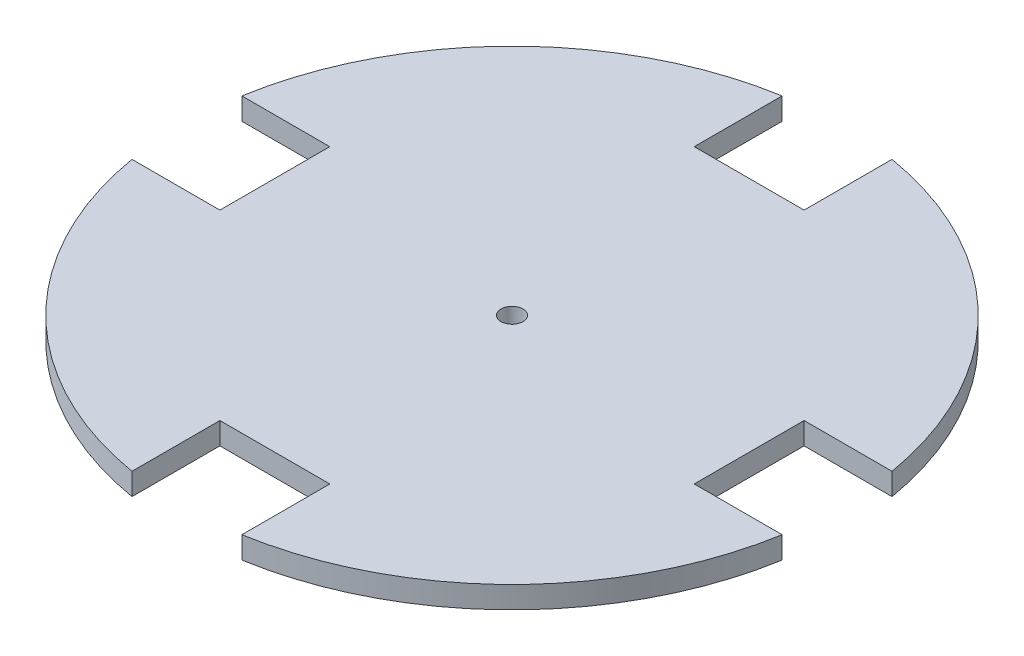
from build123d import *

# Parameters (mm, degrees)
SKETCH2_R           = 5
BOSS_EXTRUDE1_DEPTH = 5


with BuildPart() as part:
    # Sketch2 → Boss-Extrude1 (new, symmetric)
    with BuildSketch(Plane(origin=(0, 0, 0), x_dir=(1, 0, 0), z_dir=(0, 1, 0))):
        with BuildLine():
            Line((107.901994577, 25), (147.901994577, 25))
            ThreePointArc((147.901994577, 25), (106.066017178, 106.066017178), (25, 147.901994577))
            Line((25, 147.901994577), (25, 107.901994577))
            Line((25, 107.901994577), (-25, 107.901994577))
            Line((-25, 107.901994577), (-25, 147.901994577))
            ThreePointArc((-25, 147.901994577), (-106.066017178, 106.066017178), (-147.901994577, 25))
            Line((-147.901994577, 25), (-107.901994577, 25))
            Line((-107.901994577, 25), (-107.901994577, -25))
            Line((-107.901994577, -25), (-147.901994577, -25))
            ThreePointArc((-147.901994577, -25), (-106.066017178, -106.066017178), (-25, -147.901994577))
            Line((-25, -147.901994577), (-25, -107.901994577))
            Line((-25, -107.901994577), (25, -107.901994577))
            Line((25, -107.901994577), (25, -147.901994577))
            ThreePointArc((25, -147.901994577), (106.066017178, -106.066017178), (147.901994577, -25))
            Line((147.901994577, -25), (107.901994577, -25))
            Line((107.901994577, -25), (107.901994577, 25))
        make_face()
        with Locations(Location((0, 0, 0), (0, 0, 270))):
            Circle(SKETCH2_R, mode=Mode.SUBTRACT)
    extrude(amount=BOSS_EXTRUDE1_DEPTH, both=True)


solid = part.part
